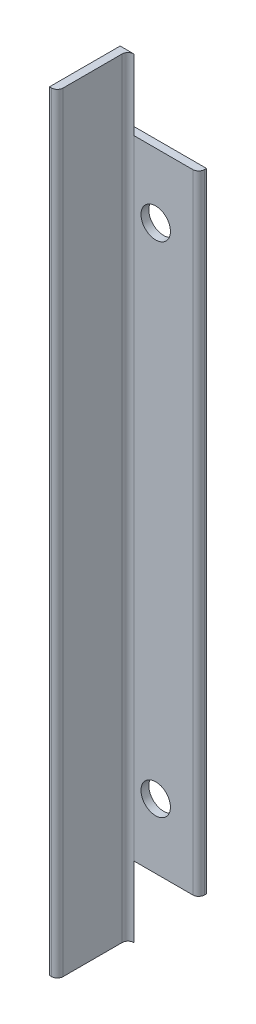
from build123d import *

# Parameters (mm, degrees)
BOSS_EXTRUDE1_DEPTH     = 392
CUT_EXTRUDE1_DEPTH      = 396.116955248
CUT_EXTRUDE1_DEPTH_BACK = 396.116955248
SKETCH2_W               = 4
SKETCH2_H               = 36
CUT_EXTRUDE2_DEPTH      = 400.775227771
CUT_EXTRUDE2_DEPTH_BACK = 400.775227771
SKETCH3_R               = 7.5


with BuildPart() as part:
    # Sketch1 → Boss-Extrude1 (new body)
    with BuildSketch(Plane(origin=(0, 0, 0), x_dir=(1, 0, 0), z_dir=(0, 1, 0))):
        with BuildLine():
            Line((-27.499872145, 29.213153277), (-67.499872145, 29.213153277))
            Line((-67.499872145, 29.213153277), (-67.499872145, -10.786846723))
            Line((-67.499872145, -10.786846723), (-66.499872145, -10.786846723))
            ThreePointArc((-66.499872145, -10.786846723), (-64.378551801, -9.908167067), (-63.499872145, -7.786846723))
            Line((-63.499872145, -7.786846723), (-63.499872145, 22.213153277))
            ThreePointArc((-63.499872145, 22.213153277), (-62.621192489, 24.334473621), (-60.499872145, 25.213153277))
            Line((-60.499872145, 25.213153277), (-30.499872145, 25.213153277))
            ThreePointArc((-30.499872145, 25.213153277), (-28.378551801, 26.091832933), (-27.499872145, 28.213153277))
            Line((-27.499872145, 28.213153277), (-27.499872145, 29.213153277))
        make_face()
    extrude(amount=BOSS_EXTRUDE1_DEPTH)

    # Sketch2 → Cut-Extrude1 (cut, two sides: drawn at the far end of the back side and taken through both)
    with BuildSketch(Plane.ZY.offset(67.499872145).offset(-CUT_EXTRUDE1_DEPTH_BACK)):
        with Locations((-27.213153277, 374)):
            Rectangle(SKETCH2_W, SKETCH2_H)
        with Locations((-27.213153277, 18)):
            Rectangle(SKETCH2_W, SKETCH2_H)
    extrude(amount=CUT_EXTRUDE1_DEPTH + CUT_EXTRUDE1_DEPTH_BACK, mode=Mode.SUBTRACT)

    # Sketch3 → Cut-Extrude2 (cut, two sides: drawn at the far end of the back side and taken through both)
    with BuildSketch(Plane(origin=(0, 0, -29.213153277), x_dir=(-1, 0, 0), z_dir=(0, 0, -1)).offset(-CUT_EXTRUDE2_DEPTH_BACK)):
        with Locations((49.390570274, 323)):
            Circle(SKETCH3_R)
        with Locations((49.390570274, 69)):
            Circle(SKETCH3_R)
    extrude(amount=CUT_EXTRUDE2_DEPTH + CUT_EXTRUDE2_DEPTH_BACK, mode=Mode.SUBTRACT)


solid = part.part
